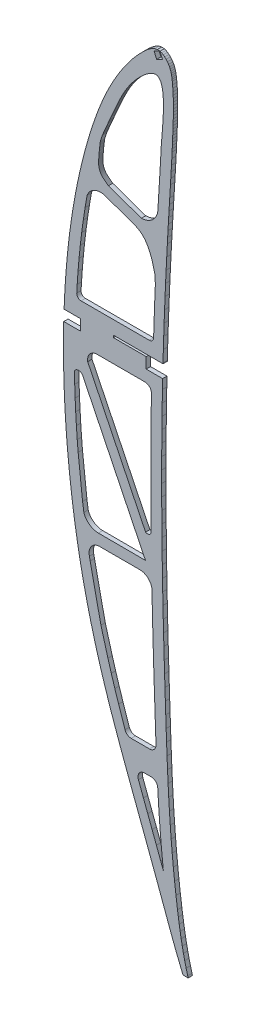
from build123d import *

# Parameters (mm, degrees)
EXTRUDE_1_DEPTH = 2


with BuildPart() as part:
    # Model → 凸台-拉伸1 (new body)
    with BuildSketch(Plane.XY):
        Polygon((80.885342789, 6.786923062), (80.601285788, 7.440020981), (79.497409228, 10.095397892), (78.416118202, 12.760769483), (77.376315784, 15.392919162), (76.35914252, 18.034064472), (75.360689456, 20.682032841), (74.374050493, 23.334520834), (73.397227535, 25.991441215), (71.451399527, 31.309627124), (69.494800085, 36.622337978), (67.525561971, 41.926489395), (65.544509756, 47.226121186), (63.556595062, 52.522450497), (61.563728747, 57.817562663), (59.568864334, 63.11258759), (57.573869064, 68.410609661), (55.594993621, 73.68331077), (53.630929423, 78.960662362), (51.691579715, 84.245098729), (49.786716882, 89.542051304), (47.926244166, 94.853954379), (46.12193205, 100.186326626), (44.381685681, 105.541515099), (42.751569504, 110.804419548), (41.194554126, 116.089533749), (39.713723933, 121.394990463), (38.308036255, 126.721745117), (36.980575476, 132.067930475), (35.731297978, 137.434545585), (34.562289094, 142.819679588), (33.490505817, 148.132986148), (32.495213059, 153.459641884), (31.574456343, 158.798560507), (30.725238524, 164.149611161), (29.946647794, 169.510752129), (29.23460072, 174.883807029), (28.588229112, 180.265735099), (28.009059649, 185.621569649), (27.491700318, 190.983105746), (27.039235501, 196.348476152), (26.650666152, 201.717637247), (26.326904079, 207.092630746), (26.069035569, 212.471502174), (25.877060622, 217.854251529), (25.752715618, 223.24696034), (25.696436752, 228.639638124), (25.710265739, 234.031373073), (25.810776934, 240.410765271), (33.537489591, 240.410765271), (33.537489591, 245.410765271), (32.537489591, 245.410765271), (25.979034241, 245.410765271), (26.185431064, 250.200488909), (26.493721757, 255.588064138), (26.883489816, 261.035250096), (27.356702309, 266.474067885), (27.915400954, 271.903605694), (28.564668229, 277.322083525), (29.307544899, 282.728633188), (30.148201634, 288.119432966), (31.091590056, 293.495700006), (31.613596949, 296.235076907), (32.163926147, 298.967682765), (32.741578602, 301.69347396), (33.347509743, 304.413493161), (33.982718618, 307.127783986), (34.647292466, 309.83434834), (35.342143097, 312.535227938), (36.086283452, 315.299317685), (36.864827641, 318.054900009), (37.677906521, 320.798977766), (38.529559905, 323.530726384), (39.42174227, 326.251232151), (40.355583523, 328.957541541), (41.335079855, 331.649829032), (41.861937078, 333.040133483), (42.401000977, 334.425966126), (42.954356886, 335.805416102), (43.522004806, 337.178483413), (44.105031024, 338.54321358), (44.704347349, 339.90164832), (45.319085592, 341.250746868), (45.983418895, 342.656062229), (46.667170308, 344.052215875), (47.371382499, 345.438252379), (48.097010896, 346.815214408), (48.843012832, 348.184057391), (49.6133845, 349.544955805), (50.406084184, 350.898821459), (51.290461417, 352.353782253), (52.200469146, 353.794847808), (53.134283753, 355.217934692), (54.090212476, 356.61596233), (55.067387126, 357.985889957), (56.062073226, 359.321548806), (57.074532492, 360.616944589), (57.704274161, 361.393152313), (58.345572413, 362.156852223), (59.003073533, 362.916254802), (59.682597333, 363.675617959), (60.388877339, 364.441154081), (61.12868879, 365.218163744), (61.905766163, 366.012815716), (62.991241546, 367.080179381), (64.135883069, 368.12209962), (65.325585791, 369.071897721), (66.545245724, 369.862851353), (67.77975888, 370.428238183), (69.014976699, 370.702378549), (70.233797096, 370.618462879), (70.980747161, 370.360799144), (71.7049624, 369.959006552), (72.395405466, 369.436626065), (73.04021444, 368.813158834), (73.629307403, 368.113188492), (74.151821486, 367.356259808), (74.596675722, 366.566912794), (74.920109097, 365.853341598), (75.182862247, 365.13111533), (75.392840319, 364.402581041), (75.559034747, 363.668131307), (75.691436013, 362.928202321), (75.797949264, 362.185141134), (75.887609553, 361.438341273), (76.026895199, 360.105147923), (76.142421785, 358.765912466), (76.2350575, 357.423675667), (76.306800442, 356.078524765), (76.359605087, 354.731546046), (76.394470483, 353.38278313), (76.41230844, 352.034277732), (76.414161626, 350.685074424), (76.403027184, 349.335304064), (76.379773306, 347.988007417), (76.346528946, 346.640274575), (76.306247629, 345.293235446), (76.259928403, 343.946933649), (76.210655651, 342.599501945), (76.158472994, 341.249941287), (76.105291289, 339.900337009), (76.049068819, 338.551600921), (75.991847301, 337.202821214), (75.931672258, 335.852911601), (75.8694555, 334.503913797), (75.805240644, 333.154828755), (75.667950358, 330.45326895), (75.521625018, 327.752315619), (75.368262722, 325.052056001), (75.208862516, 322.352533715), (75.046421547, 319.653879618), (74.715632558, 314.254311613), (74.552279779, 311.553615801), (74.389926048, 308.852963608), (74.229526794, 306.153397702), (74.072124686, 303.453962655), (73.916720673, 300.754614846), (73.764401044, 298.053399799), (73.616077608, 295.352359229), (73.329203121, 289.955709525), (73.057314357, 284.559714112), (72.801410365, 279.164416609), (72.560535716, 273.768774348), (72.335733076, 268.371831902), (72.128045115, 262.97263384), (71.938427261, 257.572222831), (71.76548789, 252.179546688), (71.610487769, 246.788654743), (71.600881766, 246.410765271), (48.775461629, 246.410765271), (48.775461629, 245.410765271), (63.871911287, 245.410765271), (63.871911287, 240.410765271), (71.429246642, 240.410765271), (71.35352432, 236.007184585), (71.251604612, 230.615607323), (71.166755962, 225.222773494), (71.09997742, 219.828726717), (71.0499646, 214.440416711), (71.016891981, 209.053847283), (70.999804133, 203.667975766), (70.998744676, 198.28180311), (71.012670942, 192.896284745), (71.040671123, 187.509378955), (71.081746169, 182.121042121), (71.136677032, 176.736313102), (71.204551902, 171.353150184), (71.284415351, 165.970510699), (71.377222808, 160.589437314), (71.482062462, 155.207888313), (71.597935267, 149.825820078), (71.726882937, 144.442320798), (71.86577747, 139.06025676), (72.015574294, 133.680670631), (72.174318934, 128.302476126), (72.341055958, 122.924630575), (72.513830892, 117.546047693), (72.692643735, 112.166727479), (72.875540009, 106.785583646), (73.062432476, 101.40461429), (73.258229138, 96.026035605), (73.467968856, 90.64906664), (73.699687634, 85.273057302), (73.957338047, 79.899181116), (74.248000671, 74.525745321), (74.577669795, 69.153011634), (74.951602376, 63.775203863), (75.373358414, 58.402486967), (75.844979624, 53.033949137), (76.371417628, 47.670807518), (76.954714142, 42.3121503), (77.597866311, 36.958108342), (78.303871279, 31.608812502), (78.685654071, 28.916903532), (79.090240496, 26.229994002), (79.520671315, 23.54721572), (79.984764439, 20.872913835), (80.487602346, 18.205308347), (81.03404942, 15.547614498), (81.630056331, 12.901093052), (82.290878913, 10.214360555), (83.001174093, 7.540798557), (83.228266295, 6.786923062), align=None)
        with BuildLine():
            Line((70.807880879, 333.155263593), (70.667950358, 330.45326895))
            Line((70.667950358, 330.45326895), (70.521625018, 327.752315619))
            Line((70.521625018, 327.752315619), (70.368262722, 325.052056001))
            Line((70.368262722, 325.052056001), (70.208862516, 322.352533715))
            Line((70.208862516, 322.352533715), (70.046421547, 319.653879618))
            Line((70.046421547, 319.653879618), (69.715632558, 314.254311613))
            Line((69.715632558, 314.254311613), (69.552279779, 311.553615801))
            Line((69.552279779, 311.553615801), (69.389926048, 308.852963608))
            Line((69.389926048, 308.852963608), (69.229526794, 306.153397702))
            ThreePointArc((69.229526794, 306.153397702), (66.64857513, 301.480661696), (61.657880879, 299.586263593))
            Line((61.657880879, 299.586263593), (46.437880879, 304.950388594))
            Line((46.437880879, 304.950388594), (46.367880879, 305.000263593))
            Line((46.367880879, 305.000263593), (46.287880879, 305.058263593))
            Line((46.287880879, 305.058263593), (46.207880879, 305.116263593))
            Line((46.207880879, 305.116263593), (46.127880879, 305.173263593))
            Line((46.127880879, 305.173263593), (46.047880879, 305.231263593))
            Line((46.047880879, 305.231263593), (45.967880879, 305.289263593))
            Line((45.967880879, 305.289263593), (45.887880879, 305.346263593))
            Line((45.887880879, 305.346263593), (45.807880879, 305.404263593))
            Line((45.807880879, 305.404263593), (45.727880879, 305.462263593))
            Line((45.727880879, 305.462263593), (45.647880879, 305.520263593))
            Line((45.647880879, 305.520263593), (45.567880879, 305.579263593))
            Line((45.567880879, 305.579263593), (45.497880879, 305.637263593))
            Line((45.497880879, 305.637263593), (45.417880879, 305.695263593))
            Line((45.417880879, 305.695263593), (45.337880879, 305.754263593))
            Line((45.337880879, 305.754263593), (45.257880879, 305.813263593))
            Line((45.257880879, 305.813263593), (45.187880879, 305.872263593))
            Line((45.187880879, 305.872263593), (45.107880879, 305.931263593))
            Line((45.107880879, 305.931263593), (45.027880879, 305.990263593))
            Line((45.027880879, 305.990263593), (44.957880879, 306.050263593))
            Line((44.957880879, 306.050263593), (44.877880879, 306.110263593))
            Line((44.877880879, 306.110263593), (44.807880879, 306.170263593))
            Line((44.807880879, 306.170263593), (44.727880879, 306.230263593))
            Line((44.727880879, 306.230263593), (44.657880879, 306.291263593))
            Line((44.657880879, 306.291263593), (44.587880879, 306.352263593))
            Line((44.587880879, 306.352263593), (44.507880879, 306.413263593))
            Line((44.507880879, 306.413263593), (44.437880879, 306.474263593))
            Line((44.437880879, 306.474263593), (44.367880879, 306.536263593))
            Line((44.367880879, 306.536263593), (44.297880879, 306.598263593))
            Line((44.297880879, 306.598263593), (44.227880879, 306.660263593))
            Line((44.227880879, 306.660263593), (44.157880879, 306.723263593))
            Line((44.157880879, 306.723263593), (44.087880879, 306.786263593))
            Line((44.087880879, 306.786263593), (44.017880879, 306.850263593))
            Line((44.017880879, 306.850263593), (43.947880879, 306.914263593))
            Line((43.947880879, 306.914263593), (43.887880879, 306.978263593))
            Line((43.887880879, 306.978263593), (43.817880879, 307.043263593))
            Line((43.817880879, 307.043263593), (43.757880879, 307.108263593))
            Line((43.757880879, 307.108263593), (43.687880879, 307.173263593))
            Line((43.687880879, 307.173263593), (43.627880879, 307.239263593))
            Line((43.627880879, 307.239263593), (43.567880879, 307.305263593))
            Line((43.567880879, 307.305263593), (43.497880879, 307.372263593))
            Line((43.497880879, 307.372263593), (43.437880879, 307.440263593))
            Line((43.437880879, 307.440263593), (43.377880879, 307.507263593))
            Line((43.377880879, 307.507263593), (43.327880879, 307.576263593))
            Line((43.327880879, 307.576263593), (43.267880879, 307.645263593))
            Line((43.267880879, 307.645263593), (43.207880879, 307.714263593))
            Line((43.207880879, 307.714263593), (43.157880879, 307.784263593))
            Line((43.157880879, 307.784263593), (43.097880879, 307.854263593))
            Line((43.097880879, 307.854263593), (43.047880879, 307.925263593))
            Line((43.047880879, 307.925263593), (42.997880879, 307.997263593))
            Line((42.997880879, 307.997263593), (42.937880879, 308.069263593))
            Line((42.937880879, 308.069263593), (42.897880879, 308.142263593))
            Line((42.897880879, 308.142263593), (42.847880879, 308.215263593))
            Line((42.847880879, 308.215263593), (42.797880879, 308.289263593))
            Line((42.797880879, 308.289263593), (42.747880879, 308.364263593))
            Line((42.747880879, 308.364263593), (42.707880879, 308.439263593))
            Line((42.707880879, 308.439263593), (42.657880879, 308.515263593))
            Line((42.657880879, 308.515263593), (42.617880879, 308.592263593))
            Line((42.617880879, 308.592263593), (42.577880879, 308.669263593))
            Line((42.577880879, 308.669263593), (42.537880879, 308.747263593))
            Line((42.537880879, 308.747263593), (42.497880879, 308.826263593))
            Line((42.497880879, 308.826263593), (42.467880879, 308.905263593))
            Line((42.467880879, 308.905263593), (42.427880879, 308.985263593))
            Line((42.427880879, 308.985263593), (42.397880879, 309.066263593))
            Line((42.397880879, 309.066263593), (42.357880879, 309.148263593))
            Line((42.357880879, 309.148263593), (42.327880879, 309.230263593))
            Line((42.327880879, 309.230263593), (42.297880879, 309.313263593))
            Line((42.297880879, 309.313263593), (42.267880879, 309.396263593))
            Line((42.267880879, 309.396263593), (42.247880879, 309.481263593))
            Line((42.247880879, 309.481263593), (42.217880879, 309.566263593))
            Line((42.217880879, 309.566263593), (42.197880879, 309.651263593))
            Line((42.197880879, 309.651263593), (42.167880879, 309.737263593))
            Line((42.167880879, 309.737263593), (42.147880879, 309.824263593))
            Line((42.147880879, 309.824263593), (42.127880879, 309.911263593))
            Line((42.127880879, 309.911263593), (42.107880879, 309.999263593))
            Line((42.107880879, 309.999263593), (42.087880879, 310.087263593))
            Line((42.087880879, 310.087263593), (42.067880879, 310.176263593))
            Line((42.067880879, 310.176263593), (42.057880879, 310.265263593))
            Line((42.057880879, 310.265263593), (42.037880879, 310.354263593))
            Line((42.037880879, 310.354263593), (42.027880879, 310.445263593))
            Line((42.027880879, 310.445263593), (42.007880879, 310.535263593))
            Line((42.007880879, 310.535263593), (41.997880879, 310.626263593))
            Line((41.997880879, 310.626263593), (41.987880879, 310.718263593))
            Line((41.987880879, 310.718263593), (41.977880879, 310.809263593))
            Line((41.977880879, 310.809263593), (41.967880879, 310.902263593))
            Line((41.967880879, 310.902263593), (41.957880879, 310.994263593))
            Line((41.957880879, 310.994263593), (41.947880879, 311.087263593))
            Line((41.947880879, 311.087263593), (41.947880879, 311.180263593))
            Line((41.947880879, 311.180263593), (41.937880879, 311.274263593))
            Line((41.937880879, 311.274263593), (41.927880879, 311.367263593))
            Line((41.927880879, 311.367263593), (41.927880879, 311.461263593))
            Line((41.927880879, 311.461263593), (41.927880879, 311.556263593))
            Line((41.927880879, 311.556263593), (41.917880879, 311.650263593))
            Line((41.917880879, 311.650263593), (41.917880879, 311.745263593))
            Line((41.917880879, 311.745263593), (41.917880879, 311.840263593))
            Line((41.917880879, 311.840263593), (41.917880879, 311.935263593))
            Line((41.917880879, 311.935263593), (41.907880879, 312.030263593))
            Line((41.907880879, 312.030263593), (41.907880879, 312.125263593))
            Line((41.907880879, 312.125263593), (41.907880879, 312.221263593))
            Line((41.907880879, 312.221263593), (41.917880879, 312.317263593))
            Line((41.917880879, 312.317263593), (41.917880879, 312.412263593))
            Line((41.917880879, 312.412263593), (41.917880879, 312.508263593))
            Line((41.917880879, 312.508263593), (41.917880879, 312.604263593))
            Line((41.917880879, 312.604263593), (41.917880879, 312.700263593))
            Line((41.917880879, 312.700263593), (41.927880879, 312.796263593))
            Line((41.927880879, 312.796263593), (41.927880879, 312.892263593))
            Line((41.927880879, 312.892263593), (41.927880879, 312.988263593))
            Line((41.927880879, 312.988263593), (41.937880879, 313.084263593))
            Line((41.937880879, 313.084263593), (41.937880879, 313.180263593))
            Line((41.937880879, 313.180263593), (41.947880879, 313.275263593))
            Line((41.947880879, 313.275263593), (41.947880879, 313.371263593))
            Line((41.947880879, 313.371263593), (41.957880879, 313.467263593))
            Line((41.957880879, 313.467263593), (41.957880879, 313.562263593))
            Line((41.957880879, 313.562263593), (41.967880879, 313.658263593))
            Line((41.967880879, 313.658263593), (41.967880879, 313.753263593))
            Line((41.967880879, 313.753263593), (41.977880879, 313.848263593))
            Line((41.977880879, 313.848263593), (41.977880879, 313.943263593))
            Line((41.977880879, 313.943263593), (41.987880879, 314.038263593))
            Line((41.987880879, 314.038263593), (41.997880879, 314.133263593))
            Line((41.997880879, 314.133263593), (41.997880879, 314.227263593))
            Line((41.997880879, 314.227263593), (42.007880879, 314.322263593))
            Line((42.007880879, 314.322263593), (42.017880879, 314.416263593))
            Line((42.017880879, 314.416263593), (42.017880879, 314.510263593))
            Line((42.017880879, 314.510263593), (42.027880879, 314.604263593))
            Line((42.027880879, 314.604263593), (42.037880879, 314.698263593))
            Line((42.037880879, 314.698263593), (42.037880879, 314.792263593))
            Line((42.037880879, 314.792263593), (42.047880879, 314.886263593))
            Line((42.047880879, 314.886263593), (42.057880879, 314.979263593))
            Line((42.057880879, 314.979263593), (42.067880879, 315.073263593))
            Line((42.067880879, 315.073263593), (42.067880879, 315.166263593))
            Line((42.067880879, 315.166263593), (42.077880879, 315.259263593))
            Line((42.077880879, 315.259263593), (42.087880879, 315.352263593))
            Line((42.087880879, 315.352263593), (42.097880879, 315.445263593))
            Line((42.097880879, 315.445263593), (42.097880879, 315.538263593))
            Line((42.097880879, 315.538263593), (42.107880879, 315.631263593))
            Line((42.107880879, 315.631263593), (42.117880879, 315.724263593))
            Line((42.117880879, 315.724263593), (42.127880879, 315.816263593))
            Line((42.127880879, 315.816263593), (42.137880879, 315.909263593))
            Line((42.137880879, 315.909263593), (42.137880879, 316.001263593))
            Line((42.137880879, 316.001263593), (42.147880879, 316.093263593))
            Line((42.147880879, 316.093263593), (42.157880879, 316.185263593))
            Line((42.157880879, 316.185263593), (42.167880879, 316.277263593))
            Line((42.167880879, 316.277263593), (42.177880879, 316.369263593))
            Line((42.177880879, 316.369263593), (42.187880879, 316.461263593))
            Line((42.187880879, 316.461263593), (42.197880879, 316.553263593))
            Line((42.197880879, 316.553263593), (42.207880879, 316.645263593))
            Line((42.207880879, 316.645263593), (42.207880879, 316.736263593))
            Line((42.207880879, 316.736263593), (42.217880879, 316.828263593))
            Line((42.217880879, 316.828263593), (42.227880879, 316.919263593))
            Line((42.227880879, 316.919263593), (42.237880879, 317.010263593))
            Line((42.237880879, 317.010263593), (42.247880879, 317.102263593))
            Line((42.247880879, 317.102263593), (42.257880879, 317.193263593))
            Line((42.257880879, 317.193263593), (42.267880879, 317.284263593))
            Line((42.267880879, 317.284263593), (42.277880879, 317.375263593))
            Line((42.277880879, 317.375263593), (42.287880879, 317.466263593))
            Line((42.287880879, 317.466263593), (42.297880879, 317.557263593))
            Line((42.297880879, 317.557263593), (42.307880879, 317.648263593))
            Line((42.307880879, 317.648263593), (42.317880879, 317.738263593))
            Line((42.317880879, 317.738263593), (42.327880879, 317.829263593))
            Line((42.327880879, 317.829263593), (42.337880879, 317.920263593))
            Line((42.337880879, 317.920263593), (42.347880879, 318.010263593))
            Line((42.347880879, 318.010263593), (42.357880879, 318.101263593))
            Line((42.357880879, 318.101263593), (42.367880879, 318.191263593))
            Line((42.367880879, 318.191263593), (42.377880879, 318.282263593))
            Line((42.377880879, 318.282263593), (42.387880879, 318.372263593))
            Line((42.387880879, 318.372263593), (42.397880879, 318.462263593))
            Line((42.397880879, 318.462263593), (42.407880879, 318.553263593))
            Line((42.407880879, 318.553263593), (42.417880879, 318.643263593))
            Line((42.417880879, 318.643263593), (42.427880879, 318.733263593))
            Line((42.427880879, 318.733263593), (42.437880879, 318.823263593))
            Line((42.437880879, 318.823263593), (42.447880879, 318.913263593))
            Line((42.447880879, 318.913263593), (42.457880879, 319.003263593))
            Line((42.457880879, 319.003263593), (42.467880879, 319.093263593))
            Line((42.467880879, 319.093263593), (42.477880879, 319.183263593))
            Line((42.477880879, 319.183263593), (42.497880879, 319.273263593))
            Line((42.497880879, 319.273263593), (42.507880879, 319.363263593))
            Line((42.507880879, 319.363263593), (42.517880879, 319.453263593))
            Line((42.517880879, 319.453263593), (42.527880879, 319.543263593))
            Line((42.527880879, 319.543263593), (42.537880879, 319.633263593))
            Line((42.537880879, 319.633263593), (42.547880879, 319.722263593))
            Line((42.547880879, 319.722263593), (42.557880879, 319.812263593))
            Line((42.557880879, 319.812263593), (42.567880879, 319.902263593))
            Line((42.567880879, 319.902263593), (42.577880879, 319.992263593))
            Line((42.577880879, 319.992263593), (42.587880879, 320.081263593))
            Line((42.587880879, 320.081263593), (42.597880879, 320.171263593))
            Line((42.597880879, 320.171263593), (42.607880879, 320.261263593))
            Line((42.607880879, 320.261263593), (42.627880879, 320.350263593))
            Line((42.627880879, 320.350263593), (42.637880879, 320.440263593))
            Line((42.637880879, 320.440263593), (42.647880879, 320.530263593))
            Line((42.647880879, 320.530263593), (42.657880879, 320.619263593))
            Line((42.657880879, 320.619263593), (42.667880879, 320.709263593))
            Line((42.667880879, 320.709263593), (42.677880879, 320.799263593))
            Line((42.677880879, 320.799263593), (43.657880879, 323.830263593))
            Line((43.657880879, 323.830263593), (43.787880879, 324.130263593))
            Line((43.787880879, 324.130263593), (43.917880879, 324.430263593))
            Line((43.917880879, 324.430263593), (44.037880879, 324.729263593))
            Line((44.037880879, 324.729263593), (44.167880879, 325.029263593))
            Line((44.167880879, 325.029263593), (44.297880879, 325.329263593))
            Line((44.297880879, 325.329263593), (44.427880879, 325.628263593))
            Line((44.427880879, 325.628263593), (44.557880879, 325.928263593))
            Line((44.557880879, 325.928263593), (44.687880879, 326.227263593))
            Line((44.687880879, 326.227263593), (44.807880879, 326.526263593))
            Line((44.807880879, 326.526263593), (44.937880879, 326.826263593))
            Line((44.937880879, 326.826263593), (45.067880879, 327.125263593))
            Line((45.067880879, 327.125263593), (45.197880879, 327.424263593))
            Line((45.197880879, 327.424263593), (45.327880879, 327.722263593))
            Line((45.327880879, 327.722263593), (45.457880879, 328.021263593))
            Line((45.457880879, 328.021263593), (45.577880879, 328.320263593))
            Line((45.577880879, 328.320263593), (45.707880879, 328.618263593))
            Line((45.707880879, 328.618263593), (45.837880879, 328.916263593))
            Line((45.837880879, 328.916263593), (45.967880879, 329.214263593))
            Line((45.967880879, 329.214263593), (46.097880879, 329.512263593))
            Line((46.097880879, 329.512263593), (46.227880879, 329.809263593))
            Line((46.227880879, 329.809263593), (46.347880879, 330.106263593))
            Line((46.347880879, 330.106263593), (46.477880879, 330.404263593))
            Line((46.477880879, 330.404263593), (46.607880879, 330.700263593))
            Line((46.607880879, 330.700263593), (46.737880879, 330.997263593))
            Line((46.737880879, 330.997263593), (46.867880879, 331.293263593))
            Line((46.867880879, 331.293263593), (46.987880879, 331.589263593))
            Line((46.987880879, 331.589263593), (47.117880879, 331.885263593))
            Line((47.117880879, 331.885263593), (47.247880879, 332.180263593))
            Line((47.247880879, 332.180263593), (47.377880879, 332.475263593))
            Line((47.377880879, 332.475263593), (47.507880879, 332.770263593))
            Line((47.507880879, 332.770263593), (47.637880879, 333.065263593))
            Line((47.637880879, 333.065263593), (47.767880879, 333.359263593))
            Line((47.767880879, 333.359263593), (47.887880879, 333.653263593))
            Line((47.887880879, 333.653263593), (48.017880879, 333.946263593))
            Line((48.017880879, 333.946263593), (48.147880879, 334.239263593))
            Line((48.147880879, 334.239263593), (48.277880879, 334.532263593))
            Line((48.277880879, 334.532263593), (48.407880879, 334.824263593))
            Line((48.407880879, 334.824263593), (48.537880879, 335.116263593))
            Line((48.537880879, 335.116263593), (48.657880879, 335.407263593))
            Line((48.657880879, 335.407263593), (48.787880879, 335.698263593))
            Line((48.787880879, 335.698263593), (48.917880879, 335.989263593))
            Line((48.917880879, 335.989263593), (49.047880879, 336.279263593))
            Line((49.047880879, 336.279263593), (49.177880879, 336.569263593))
            Line((49.177880879, 336.569263593), (49.307880879, 336.858263593))
            Line((49.307880879, 336.858263593), (49.437880879, 337.146263593))
            Line((49.437880879, 337.146263593), (49.557880879, 337.435263593))
            Line((49.557880879, 337.435263593), (49.687880879, 337.722263593))
            Line((49.687880879, 337.722263593), (49.817880879, 338.009263593))
            Line((49.817880879, 338.009263593), (49.947880879, 338.296263593))
            Line((49.947880879, 338.296263593), (50.077880879, 338.582263593))
            Line((50.077880879, 338.582263593), (50.207880879, 338.868263593))
            Line((50.207880879, 338.868263593), (50.337880879, 339.153263593))
            Line((50.337880879, 339.153263593), (50.457880879, 339.437263593))
            Line((50.457880879, 339.437263593), (50.587880879, 339.721263593))
            Line((50.587880879, 339.721263593), (50.717880879, 340.005263593))
            Line((50.717880879, 340.005263593), (50.847880879, 340.288263593))
            Line((50.847880879, 340.288263593), (50.977880879, 340.570263593))
            Line((50.977880879, 340.570263593), (51.107880879, 340.852263593))
            Line((51.107880879, 340.852263593), (51.237880879, 341.134263593))
            Line((51.237880879, 341.134263593), (51.377880879, 341.415263593))
            Line((51.377880879, 341.415263593), (51.507880879, 341.696263593))
            Line((51.507880879, 341.696263593), (51.637880879, 341.976263593))
            Line((51.637880879, 341.976263593), (51.777880879, 342.255263593))
            Line((51.777880879, 342.255263593), (51.907880879, 342.535263593))
            Line((51.907880879, 342.535263593), (52.047880879, 342.814263593))
            Line((52.047880879, 342.814263593), (52.177880879, 343.092263593))
            Line((52.177880879, 343.092263593), (52.317880879, 343.370263593))
            Line((52.317880879, 343.370263593), (52.457880879, 343.648263593))
            Line((52.457880879, 343.648263593), (52.597880879, 343.925263593))
            Line((52.597880879, 343.925263593), (52.747880879, 344.202263593))
            Line((52.747880879, 344.202263593), (52.887880879, 344.479263593))
            Line((52.887880879, 344.479263593), (53.037880879, 344.755263593))
            Line((53.037880879, 344.755263593), (53.177880879, 345.031263593))
            Line((53.177880879, 345.031263593), (53.327880879, 345.307263593))
            Line((53.327880879, 345.307263593), (53.477880879, 345.582263593))
            Line((53.477880879, 345.582263593), (53.627880879, 345.857263593))
            Line((53.627880879, 345.857263593), (53.787880879, 346.132263593))
            Line((53.787880879, 346.132263593), (53.937880879, 346.406263593))
            Line((53.937880879, 346.406263593), (54.097880879, 346.680263593))
            Line((54.097880879, 346.680263593), (54.257880879, 346.954263593))
            Line((54.257880879, 346.954263593), (54.417880879, 347.228263593))
            Line((54.417880879, 347.228263593), (54.587880879, 347.501263593))
            Line((54.587880879, 347.501263593), (54.757880879, 347.774263593))
            Line((54.757880879, 347.774263593), (54.927880879, 348.047263593))
            Line((54.927880879, 348.047263593), (55.097880879, 348.320263593))
            Line((55.097880879, 348.320263593), (55.267880879, 348.592263593))
            Line((55.267880879, 348.592263593), (55.447880879, 348.865263593))
            Line((55.447880879, 348.865263593), (55.627880879, 349.137263593))
            Line((55.627880879, 349.137263593), (55.807880879, 349.409263593))
            Line((55.807880879, 349.409263593), (55.997880879, 349.680263593))
            Line((55.997880879, 349.680263593), (56.177880879, 349.952263593))
            Line((56.177880879, 349.952263593), (56.377880879, 350.223263593))
            Line((56.377880879, 350.223263593), (56.567880879, 350.495263593))
            Line((56.567880879, 350.495263593), (56.767880879, 350.766263593))
            Line((56.767880879, 350.766263593), (56.967880879, 351.037263593))
            Line((56.967880879, 351.037263593), (57.167880879, 351.308263593))
            Line((57.167880879, 351.308263593), (57.377880879, 351.579263593))
            Line((57.377880879, 351.579263593), (57.587880879, 351.850263593))
            Line((57.587880879, 351.850263593), (57.807880879, 352.120263593))
            Line((57.807880879, 352.120263593), (58.017880879, 352.391263593))
            Line((58.017880879, 352.391263593), (58.237880879, 352.661263593))
            Line((58.237880879, 352.661263593), (58.467880879, 352.932263593))
            Line((58.467880879, 352.932263593), (58.697880879, 353.202263593))
            Line((58.697880879, 353.202263593), (58.927880879, 353.473263593))
            Line((58.927880879, 353.473263593), (59.167880879, 353.743263593))
            Line((59.167880879, 353.743263593), (59.407880879, 354.014263593))
            Line((59.407880879, 354.014263593), (59.647880879, 354.284263593))
            Line((59.647880879, 354.284263593), (59.897880879, 354.553263593))
            Line((59.897880879, 354.553263593), (60.147880879, 354.822263593))
            Line((60.147880879, 354.822263593), (60.407880879, 355.089263593))
            Line((60.407880879, 355.089263593), (60.667880879, 355.354263593))
            Line((60.667880879, 355.354263593), (60.927880879, 355.617263593))
            Line((60.927880879, 355.617263593), (61.187880879, 355.877263593))
            Line((61.187880879, 355.877263593), (61.447880879, 356.134263593))
            Line((61.447880879, 356.134263593), (61.717880879, 356.387263593))
            Line((61.717880879, 356.387263593), (61.977880879, 356.637263593))
            Line((61.977880879, 356.637263593), (62.247880879, 356.882263593))
            Line((62.247880879, 356.882263593), (62.507880879, 357.122263593))
            Line((62.507880879, 357.122263593), (62.777880879, 357.356263593))
            Line((62.777880879, 357.356263593), (63.047880879, 357.585263593))
            Line((63.047880879, 357.585263593), (63.307880879, 357.808263593))
            Line((63.307880879, 357.808263593), (63.577880879, 358.025263593))
            Line((63.577880879, 358.025263593), (63.837880879, 358.234263593))
            Line((63.837880879, 358.234263593), (64.107880879, 358.437263593))
            Line((64.107880879, 358.437263593), (64.367880879, 358.631263593))
            Line((64.367880879, 358.631263593), (64.627880879, 358.817263593))
            Line((64.627880879, 358.817263593), (64.877880879, 358.994263593))
            Line((64.877880879, 358.994263593), (65.137880879, 359.163263593))
            Line((65.137880879, 359.163263593), (65.387880879, 359.322263593))
            Line((65.387880879, 359.322263593), (65.627880879, 359.471263593))
            Line((65.627880879, 359.471263593), (65.877880879, 359.610263593))
            Line((65.877880879, 359.610263593), (66.117880879, 359.737263593))
            Line((66.117880879, 359.737263593), (66.347880879, 359.854263593))
            Line((66.347880879, 359.854263593), (66.577880879, 359.959263593))
            Line((66.577880879, 359.959263593), (66.807880879, 360.053263593))
            Line((66.807880879, 360.053263593), (67.027880879, 360.133263593))
            Line((67.027880879, 360.133263593), (67.237880879, 360.201263593))
            Line((67.237880879, 360.201263593), (67.447880879, 360.256263593))
            Line((67.447880879, 360.256263593), (67.647880879, 360.297263593))
            Line((67.647880879, 360.297263593), (67.847880879, 360.326263593))
            Line((67.847880879, 360.326263593), (68.037880879, 360.341263593))
            Line((68.037880879, 360.341263593), (68.227880879, 360.344263593))
            Line((68.227880879, 360.344263593), (68.407880879, 360.334263593))
            Line((68.407880879, 360.334263593), (68.577880879, 360.311263593))
            Line((68.577880879, 360.311263593), (68.747880879, 360.277263593))
            Line((68.747880879, 360.277263593), (68.907880879, 360.230263593))
            Line((68.907880879, 360.230263593), (69.067880879, 360.171263593))
            Line((69.067880879, 360.171263593), (69.227880879, 360.100263593))
            Line((69.227880879, 360.100263593), (69.367880879, 360.018263593))
            Line((69.367880879, 360.018263593), (69.517880879, 359.924263593))
            Line((69.517880879, 359.924263593), (69.647880879, 359.819263593))
            Line((69.647880879, 359.819263593), (69.777880879, 359.703263593))
            Line((69.777880879, 359.703263593), (69.907880879, 359.575263593))
            Line((69.907880879, 359.575263593), (70.027880879, 359.437263593))
            Line((70.027880879, 359.437263593), (70.147880879, 359.288263593))
            Line((70.147880879, 359.288263593), (70.257880879, 359.129263593))
            Line((70.257880879, 359.129263593), (70.367880879, 358.959263593))
            Line((70.367880879, 358.959263593), (70.477880879, 358.779263593))
            Line((70.477880879, 358.779263593), (70.577880879, 358.588263593))
            Line((70.577880879, 358.588263593), (70.667880879, 358.388263593))
            Line((70.667880879, 358.388263593), (70.757880879, 358.178263593))
            Line((70.757880879, 358.178263593), (70.847880879, 357.959263593))
            Line((70.847880879, 357.959263593), (70.927880879, 357.730263593))
            Line((70.927880879, 357.730263593), (71.007880879, 357.491263593))
            Line((71.007880879, 357.491263593), (71.077880879, 357.244263593))
            Line((71.077880879, 357.244263593), (71.147880879, 356.988263593))
            Line((71.147880879, 356.988263593), (71.217880879, 356.722263593))
            Line((71.217880879, 356.722263593), (71.277880879, 356.448263593))
            Line((71.277880879, 356.448263593), (71.337880879, 356.166263593))
            Line((71.337880879, 356.166263593), (71.387880879, 355.875263593))
            Line((71.387880879, 355.875263593), (71.437880879, 355.576263593))
            Line((71.437880879, 355.576263593), (71.487880879, 355.269263593))
            Line((71.487880879, 355.269263593), (71.527880879, 354.954263593))
            Line((71.527880879, 354.954263593), (71.567880879, 354.632263593))
            Line((71.567880879, 354.632263593), (71.607880879, 354.302263593))
            Line((71.607880879, 354.302263593), (71.637880879, 353.964263593))
            Line((71.637880879, 353.964263593), (71.667880879, 353.619263593))
            Line((71.667880879, 353.619263593), (71.697880879, 353.267263593))
            Line((71.697880879, 353.267263593), (71.717880879, 352.908263593))
            Line((71.717880879, 352.908263593), (71.737880879, 352.543263593))
            Line((71.737880879, 352.543263593), (71.757880879, 352.171263593))
            Line((71.757880879, 352.171263593), (71.767880879, 351.792263593))
            Line((71.767880879, 351.792263593), (71.787880879, 351.407263593))
            Line((71.787880879, 351.407263593), (71.797880879, 351.016263593))
            Line((71.797880879, 351.016263593), (71.797880879, 350.619263593))
            Line((71.797880879, 350.619263593), (71.807880879, 350.216263593))
            Line((71.807880879, 350.216263593), (71.807880879, 349.807263593))
            Line((71.807880879, 349.807263593), (71.807880879, 349.393263593))
            Line((71.807880879, 349.393263593), (71.797880879, 348.973263593))
            Line((71.797880879, 348.973263593), (71.797880879, 348.548263593))
            Line((71.797880879, 348.548263593), (71.787880879, 348.119263593))
            Line((71.787880879, 348.119263593), (71.777880879, 347.684263593))
            Line((71.777880879, 347.684263593), (71.767880879, 347.245263593))
            Line((71.767880879, 347.245263593), (71.747880879, 346.801263593))
            Line((71.747880879, 346.801263593), (71.737880879, 346.352263593))
            Line((71.737880879, 346.352263593), (71.717880879, 345.900263593))
            Line((71.717880879, 345.900263593), (71.697880879, 345.443263593))
            Line((71.697880879, 345.443263593), (71.677880879, 344.982263593))
            Line((71.677880879, 344.982263593), (71.647880879, 344.518263593))
            Line((71.647880879, 344.518263593), (71.627880879, 344.050263593))
            Line((71.627880879, 344.050263593), (71.597880879, 343.578263593))
            Line((71.597880879, 343.578263593), (71.567880879, 343.104263593))
            Line((71.567880879, 343.104263593), (71.537880879, 342.626263593))
            Line((71.537880879, 342.626263593), (71.507880879, 342.145263593))
            Line((71.507880879, 342.145263593), (71.477880879, 341.661263593))
            Line((71.477880879, 341.661263593), (71.447880879, 341.174263593))
            Line((71.447880879, 341.174263593), (71.407880879, 340.685263593))
            Line((71.407880879, 340.685263593), (71.377880879, 340.194263593))
            Line((71.377880879, 340.194263593), (71.337880879, 339.700263593))
            Line((71.337880879, 339.700263593), (71.297880879, 339.205263593))
            Line((71.297880879, 339.205263593), (71.257880879, 338.707263593))
            Line((71.257880879, 338.707263593), (71.227880879, 338.208263593))
            Line((71.227880879, 338.208263593), (71.187880879, 337.707263593))
            Line((71.187880879, 337.707263593), (71.147880879, 337.205263593))
            Line((71.147880879, 337.205263593), (71.097880879, 336.701263593))
            Line((71.097880879, 336.701263593), (71.057880879, 336.197263593))
            Line((71.057880879, 336.197263593), (71.017880879, 335.691263593))
            Line((71.017880879, 335.691263593), (70.977880879, 335.185263593))
            Line((70.977880879, 335.185263593), (70.937880879, 334.678263593))
            Line((70.937880879, 334.678263593), (70.887880879, 334.170263593))
            Line((70.887880879, 334.170263593), (70.847880879, 333.662263593))
            Line((70.847880879, 333.662263593), (70.807880879, 333.155263593))
        make_face(mode=Mode.SUBTRACT)
        with BuildLine():
            Line((67.827880879, 280.445263593), (68.082542608, 276.508151249))
            Line((68.082542608, 276.508151249), (67.857739969, 271.111208802))
            Line((67.857739969, 271.111208802), (67.650052008, 265.712010741))
            Line((67.650052008, 265.712010741), (67.460434153, 260.311599731))
            Line((67.460434153, 260.311599731), (67.287494783, 254.918923589))
            Line((67.287494783, 254.918923589), (67.278114023, 254.592661482))
            ThreePointArc((67.278114023, 254.592661482), (66.672683115, 253.215750074), (65.278940201, 252.650142172))
            Line((65.278940201, 252.650142172), (33.808576042, 252.650142172))
            ThreePointArc((33.808576042, 252.650142172), (32.35452716, 253.276919011), (31.81184244, 254.764400323))
            Line((31.81184244, 254.764400323), (32.01572865, 258.327441039))
            Line((32.01572865, 258.327441039), (32.405496709, 263.774626997))
            Line((32.405496709, 263.774626997), (32.878709202, 269.213444785))
            Line((32.878709202, 269.213444785), (33.437407847, 274.642982595))
            Line((33.437407847, 274.642982595), (34.086675122, 280.061460426))
            Line((34.086675122, 280.061460426), (34.829551792, 285.468010088))
            Line((34.829551792, 285.468010088), (35.670208527, 290.858809867))
            Line((35.670208527, 290.858809867), (36.613596949, 296.235076907))
            ThreePointArc((36.613596949, 296.235076907), (40.042468405, 299.965785514), (45.107250849, 300.118510672))
            Line((45.107250849, 300.118510672), (55.897880879, 296.317263593))
            Line((55.897880879, 296.317263593), (56.007880879, 296.280263593))
            Line((56.007880879, 296.280263593), (56.117880879, 296.242263593))
            Line((56.117880879, 296.242263593), (56.227880879, 296.204263593))
            Line((56.227880879, 296.204263593), (56.327880879, 296.167263593))
            Line((56.327880879, 296.167263593), (56.437880879, 296.129263593))
            Line((56.437880879, 296.129263593), (56.547880879, 296.091263593))
            Line((56.547880879, 296.091263593), (56.657880879, 296.053263593))
            Line((56.657880879, 296.053263593), (56.757880879, 296.015263593))
            Line((56.757880879, 296.015263593), (56.867880879, 295.977263593))
            Line((56.867880879, 295.977263593), (56.977880879, 295.939263593))
            Line((56.977880879, 295.939263593), (57.077880879, 295.900263593))
            Line((57.077880879, 295.900263593), (57.187880879, 295.862263593))
            Line((57.187880879, 295.862263593), (57.287880879, 295.823263593))
            Line((57.287880879, 295.823263593), (57.397880879, 295.783263593))
            Line((57.397880879, 295.783263593), (57.507880879, 295.744263593))
            Line((57.507880879, 295.744263593), (57.607880879, 295.704263593))
            Line((57.607880879, 295.704263593), (57.717880879, 295.664263593))
            Line((57.717880879, 295.664263593), (57.817880879, 295.624263593))
            Line((57.817880879, 295.624263593), (57.927880879, 295.583263593))
            Line((57.927880879, 295.583263593), (58.027880879, 295.542263593))
            Line((58.027880879, 295.542263593), (58.137880879, 295.500263593))
            Line((58.137880879, 295.500263593), (58.237880879, 295.458263593))
            Line((58.237880879, 295.458263593), (58.347880879, 295.416263593))
            Line((58.347880879, 295.416263593), (58.447880879, 295.373263593))
            Line((58.447880879, 295.373263593), (58.547880879, 295.330263593))
            Line((58.547880879, 295.330263593), (58.657880879, 295.286263593))
            Line((58.657880879, 295.286263593), (58.757880879, 295.242263593))
            Line((58.757880879, 295.242263593), (58.857880879, 295.197263593))
            Line((58.857880879, 295.197263593), (58.957880879, 295.152263593))
            Line((58.957880879, 295.152263593), (59.057880879, 295.106263593))
            Line((59.057880879, 295.106263593), (59.157880879, 295.060263593))
            Line((59.157880879, 295.060263593), (59.257880879, 295.013263593))
            Line((59.257880879, 295.013263593), (59.357880879, 294.966263593))
            Line((59.357880879, 294.966263593), (59.457880879, 294.917263593))
            Line((59.457880879, 294.917263593), (59.557880879, 294.869263593))
            Line((59.557880879, 294.869263593), (59.657880879, 294.819263593))
            Line((59.657880879, 294.819263593), (59.757880879, 294.769263593))
            Line((59.757880879, 294.769263593), (59.857880879, 294.718263593))
            Line((59.857880879, 294.718263593), (59.957880879, 294.667263593))
            Line((59.957880879, 294.667263593), (60.047880879, 294.614263593))
            Line((60.047880879, 294.614263593), (60.147880879, 294.561263593))
            Line((60.147880879, 294.561263593), (60.237880879, 294.507263593))
            Line((60.237880879, 294.507263593), (60.337880879, 294.453263593))
            Line((60.337880879, 294.453263593), (60.427880879, 294.397263593))
            Line((60.427880879, 294.397263593), (60.527880879, 294.341263593))
            Line((60.527880879, 294.341263593), (60.617880879, 294.284263593))
            Line((60.617880879, 294.284263593), (60.707880879, 294.226263593))
            Line((60.707880879, 294.226263593), (60.797880879, 294.167263593))
            Line((60.797880879, 294.167263593), (60.897880879, 294.107263593))
            Line((60.897880879, 294.107263593), (60.987880879, 294.046263593))
            Line((60.987880879, 294.046263593), (61.077880879, 293.984263593))
            Line((61.077880879, 293.984263593), (61.157880879, 293.922263593))
            Line((61.157880879, 293.922263593), (61.247880879, 293.858263593))
            Line((61.247880879, 293.858263593), (61.337880879, 293.793263593))
            Line((61.337880879, 293.793263593), (61.427880879, 293.727263593))
            Line((61.427880879, 293.727263593), (61.507880879, 293.661263593))
            Line((61.507880879, 293.661263593), (61.597880879, 293.593263593))
            Line((61.597880879, 293.593263593), (61.677880879, 293.524263593))
            Line((61.677880879, 293.524263593), (61.767880879, 293.454263593))
            Line((61.767880879, 293.454263593), (61.847880879, 293.383263593))
            Line((61.847880879, 293.383263593), (61.927880879, 293.311263593))
            Line((61.927880879, 293.311263593), (62.017880879, 293.238263593))
            Line((62.017880879, 293.238263593), (62.097880879, 293.164263593))
            Line((62.097880879, 293.164263593), (62.177880879, 293.089263593))
            Line((62.177880879, 293.089263593), (62.257880879, 293.013263593))
            Line((62.257880879, 293.013263593), (62.327880879, 292.937263593))
            Line((62.327880879, 292.937263593), (62.407880879, 292.859263593))
            Line((62.407880879, 292.859263593), (62.487880879, 292.780263593))
            Line((62.487880879, 292.780263593), (62.567880879, 292.701263593))
            Line((62.567880879, 292.701263593), (62.637880879, 292.620263593))
            Line((62.637880879, 292.620263593), (62.717880879, 292.539263593))
            Line((62.717880879, 292.539263593), (62.787880879, 292.457263593))
            Line((62.787880879, 292.457263593), (62.857880879, 292.374263593))
            Line((62.857880879, 292.374263593), (62.937880879, 292.291263593))
            Line((62.937880879, 292.291263593), (63.007880879, 292.206263593))
            Line((63.007880879, 292.206263593), (63.077880879, 292.121263593))
            Line((63.077880879, 292.121263593), (63.147880879, 292.035263593))
            Line((63.147880879, 292.035263593), (63.217880879, 291.949263593))
            Line((63.217880879, 291.949263593), (63.287880879, 291.861263593))
            Line((63.287880879, 291.861263593), (63.357880879, 291.773263593))
            Line((63.357880879, 291.773263593), (63.427880879, 291.684263593))
            Line((63.427880879, 291.684263593), (63.487880879, 291.595263593))
            Line((63.487880879, 291.595263593), (63.557880879, 291.505263593))
            Line((63.557880879, 291.505263593), (63.627880879, 291.414263593))
            Line((63.627880879, 291.414263593), (63.687880879, 291.323263593))
            Line((63.687880879, 291.323263593), (63.757880879, 291.231263593))
            Line((63.757880879, 291.231263593), (63.817880879, 291.138263593))
            Line((63.817880879, 291.138263593), (63.877880879, 291.045263593))
            Line((63.877880879, 291.045263593), (63.947880879, 290.952263593))
            Line((63.947880879, 290.952263593), (64.007880879, 290.857263593))
            Line((64.007880879, 290.857263593), (64.067880879, 290.763263593))
            Line((64.067880879, 290.763263593), (64.127880879, 290.668263593))
            Line((64.127880879, 290.668263593), (64.187880879, 290.572263593))
            Line((64.187880879, 290.572263593), (64.247880879, 290.476263593))
            Line((64.247880879, 290.476263593), (64.307880879, 290.379263593))
            Line((64.307880879, 290.379263593), (64.367880879, 290.282263593))
            Line((64.367880879, 290.282263593), (64.427880879, 290.185263593))
            Line((64.427880879, 290.185263593), (64.477880879, 290.087263593))
            Line((64.477880879, 290.087263593), (64.537880879, 289.988263593))
            Line((64.537880879, 289.988263593), (64.587880879, 289.890263593))
            Line((64.587880879, 289.890263593), (64.647880879, 289.791263593))
            Line((64.647880879, 289.791263593), (64.697880879, 289.692263593))
            Line((64.697880879, 289.692263593), (64.757880879, 289.592263593))
            Line((64.757880879, 289.592263593), (64.807880879, 289.492263593))
            Line((64.807880879, 289.492263593), (64.857880879, 289.392263593))
            Line((64.857880879, 289.392263593), (64.917880879, 289.291263593))
            Line((64.917880879, 289.291263593), (64.967880879, 289.190263593))
            Line((64.967880879, 289.190263593), (65.017880879, 289.089263593))
            Line((65.017880879, 289.089263593), (65.067880879, 288.988263593))
            Line((65.067880879, 288.988263593), (65.117880879, 288.887263593))
            Line((65.117880879, 288.887263593), (65.167880879, 288.785263593))
            Line((65.167880879, 288.785263593), (65.217880879, 288.683263593))
            Line((65.217880879, 288.683263593), (65.257880879, 288.581263593))
            Line((65.257880879, 288.581263593), (65.307880879, 288.479263593))
            Line((65.307880879, 288.479263593), (65.357880879, 288.377263593))
            Line((65.357880879, 288.377263593), (65.407880879, 288.275263593))
            Line((65.407880879, 288.275263593), (65.447880879, 288.172263593))
            Line((65.447880879, 288.172263593), (65.497880879, 288.069263593))
            Line((65.497880879, 288.069263593), (65.537880879, 287.967263593))
            Line((65.537880879, 287.967263593), (65.587880879, 287.864263593))
            Line((65.587880879, 287.864263593), (65.627880879, 287.761263593))
            Line((65.627880879, 287.761263593), (65.667880879, 287.658263593))
            Line((65.667880879, 287.658263593), (65.717880879, 287.554263593))
            Line((65.717880879, 287.554263593), (65.757880879, 287.451263593))
            Line((65.757880879, 287.451263593), (65.797880879, 287.347263593))
            Line((65.797880879, 287.347263593), (65.837880879, 287.244263593))
            Line((65.837880879, 287.244263593), (65.877880879, 287.140263593))
            Line((65.877880879, 287.140263593), (65.917880879, 287.036263593))
            Line((65.917880879, 287.036263593), (65.957880879, 286.932263593))
            Line((65.957880879, 286.932263593), (65.997880879, 286.828263593))
            Line((65.997880879, 286.828263593), (66.037880879, 286.724263593))
            Line((66.037880879, 286.724263593), (66.077880879, 286.619263593))
            Line((66.077880879, 286.619263593), (66.117880879, 286.515263593))
            Line((66.117880879, 286.515263593), (66.157880879, 286.410263593))
            Line((66.157880879, 286.410263593), (66.187880879, 286.306263593))
            Line((66.187880879, 286.306263593), (66.227880879, 286.201263593))
            Line((66.227880879, 286.201263593), (66.267880879, 286.096263593))
            Line((66.267880879, 286.096263593), (66.297880879, 285.991263593))
            Line((66.297880879, 285.991263593), (66.337880879, 285.886263593))
            Line((66.337880879, 285.886263593), (66.367880879, 285.781263593))
            Line((66.367880879, 285.781263593), (66.407880879, 285.676263593))
            Line((66.407880879, 285.676263593), (66.437880879, 285.571263593))
            Line((66.437880879, 285.571263593), (66.477880879, 285.465263593))
            Line((66.477880879, 285.465263593), (66.507880879, 285.360263593))
            Line((66.507880879, 285.360263593), (66.547880879, 285.254263593))
            Line((66.547880879, 285.254263593), (66.577880879, 285.148263593))
            Line((66.577880879, 285.148263593), (66.607880879, 285.043263593))
            Line((66.607880879, 285.043263593), (66.647880879, 284.937263593))
            Line((66.647880879, 284.937263593), (66.677880879, 284.831263593))
            Line((66.677880879, 284.831263593), (66.707880879, 284.725263593))
            Line((66.707880879, 284.725263593), (66.737880879, 284.619263593))
            Line((66.737880879, 284.619263593), (66.767880879, 284.513263593))
            Line((66.767880879, 284.513263593), (66.807880879, 284.407263593))
            Line((66.807880879, 284.407263593), (66.837880879, 284.300263593))
            Line((66.837880879, 284.300263593), (66.867880879, 284.194263593))
            Line((66.867880879, 284.194263593), (66.897880879, 284.088263593))
            Line((66.897880879, 284.088263593), (66.927880879, 283.981263593))
            Line((66.927880879, 283.981263593), (66.957880879, 283.875263593))
            Line((66.957880879, 283.875263593), (66.987880879, 283.768263593))
            Line((66.987880879, 283.768263593), (67.017880879, 283.662263593))
            Line((67.017880879, 283.662263593), (67.047880879, 283.555263593))
            Line((67.047880879, 283.555263593), (67.077880879, 283.448263593))
            Line((67.077880879, 283.448263593), (67.097880879, 283.341263593))
            Line((67.097880879, 283.341263593), (67.127880879, 283.235263593))
            Line((67.127880879, 283.235263593), (67.157880879, 283.128263593))
            Line((67.157880879, 283.128263593), (67.187880879, 283.021263593))
            Line((67.187880879, 283.021263593), (67.217880879, 282.914263593))
            Line((67.217880879, 282.914263593), (67.247880879, 282.807263593))
            Line((67.247880879, 282.807263593), (67.267880879, 282.700263593))
            Line((67.267880879, 282.700263593), (67.297880879, 282.593263593))
            Line((67.297880879, 282.593263593), (67.327880879, 282.485263593))
            Line((67.327880879, 282.485263593), (67.357880879, 282.378263593))
            Line((67.357880879, 282.378263593), (67.377880879, 282.271263593))
            Line((67.377880879, 282.271263593), (67.407880879, 282.164263593))
            Line((67.407880879, 282.164263593), (67.437880879, 282.057263593))
            Line((67.437880879, 282.057263593), (67.467880879, 281.949263593))
            Line((67.467880879, 281.949263593), (67.487880879, 281.842263593))
            Line((67.487880879, 281.842263593), (67.517880879, 281.735263593))
            Line((67.517880879, 281.735263593), (67.547880879, 281.627263593))
            Line((67.547880879, 281.627263593), (67.567880879, 281.520263593))
            Line((67.567880879, 281.520263593), (67.597880879, 281.412263593))
            Line((67.597880879, 281.412263593), (67.617880879, 281.305263593))
            Line((67.617880879, 281.305263593), (67.647880879, 281.197263593))
            Line((67.647880879, 281.197263593), (67.677880879, 281.090263593))
            Line((67.677880879, 281.090263593), (67.697880879, 280.982263593))
            Line((67.697880879, 280.982263593), (67.727880879, 280.875263593))
            Line((67.727880879, 280.875263593), (67.757880879, 280.767263593))
            Line((67.757880879, 280.767263593), (67.777880879, 280.660263593))
            Line((67.777880879, 280.660263593), (67.807880879, 280.552263593))
            Line((67.807880879, 280.552263593), (67.827880879, 280.445263593))
        make_face(mode=Mode.SUBTRACT)
        Polygon((70.194098278, 370.589465249), (67.469162132, 369.336412575), (68.721215758, 366.61143281), (71.447194571, 367.863530055), align=None, mode=Mode.SUBTRACT)
        with BuildLine():
            Line((69.179620347, 75.789881997), (69.248000671, 74.525745321))
            Line((69.248000671, 74.525745321), (69.577669795, 69.153011634))
            Line((69.577669795, 69.153011634), (69.951602376, 63.775203863))
            Line((69.951602376, 63.775203863), (70.373358414, 58.402486967))
            Line((70.373358414, 58.402486967), (70.844979624, 53.033949137))
            Line((70.844979624, 53.033949137), (71.779421931, 43.92253344))
            Line((71.779421931, 43.92253344), (70.544509756, 47.226121186))
            Line((70.544509756, 47.226121186), (68.556595062, 52.522450497))
            Line((68.556595062, 52.522450497), (66.563728747, 57.817562663))
            Line((66.563728747, 57.817562663), (64.568864334, 63.11258759))
            Line((64.568864334, 63.11258759), (62.573869064, 68.410609661))
            Line((62.573869064, 68.410609661), (60.260818599, 74.573718002))
            ThreePointArc((60.260818599, 74.573718002), (60.603517741, 77.33629533), (63.069523629, 78.627841362))
            Line((63.069523629, 78.627841362), (66.183999738, 78.627841362))
            ThreePointArc((66.183999738, 78.627841362), (68.247234831, 77.805698325), (69.179620347, 75.789881997))
        make_face(mode=Mode.SUBTRACT)
        with BuildLine():
            Line((34.505244835, 172.84154642), (35.096007236, 168.770163227))
            ThreePointArc((35.096007236, 168.770163227), (37.651556069, 165.223802539), (41.804131112, 163.85865622))
            Line((41.804131112, 163.85865622), (63.537115804, 163.792899871))
            Line((63.537115804, 163.792899871), (34.663753418, 222.992065691))
            ThreePointArc((34.663753418, 222.992065691), (32.785821984, 224.309995093), (30.752715618, 223.24696034))
            Line((30.752715618, 223.24696034), (30.877060622, 217.854251529))
            Line((30.877060622, 217.854251529), (31.069035569, 212.471502174))
            Line((31.069035569, 212.471502174), (31.326904079, 207.092630746))
            Line((31.326904079, 207.092630746), (31.650666152, 201.717637247))
            Line((31.650666152, 201.717637247), (32.039235501, 196.348476152))
            Line((32.039235501, 196.348476152), (32.450591643, 191.470576278))
            Line((32.450591643, 191.470576278), (34.505244835, 172.84154642))
        make_face(mode=Mode.SUBTRACT)
        with BuildLine():
            Line((66.1092116, 179.428677612), (66.140230025, 176.561684469))
            ThreePointArc((66.140230025, 176.561684469), (65.290081357, 175.072924271), (63.576281214, 175.11818744))
            Line((63.576281214, 175.11818744), (36.868721555, 229.876799608))
            ThreePointArc((36.868721555, 229.876799608), (37.839951668, 233.433418115), (41.183566021, 234.986822824))
            Line((41.183566021, 234.986822824), (63.272807462, 234.986822824))
            ThreePointArc((63.272807462, 234.986822824), (65.410748622, 234.091391092), (66.272436212, 231.939627888))
            Line((66.272436212, 231.939627888), (66.166755962, 225.222773494))
            Line((66.166755962, 225.222773494), (66.09997742, 219.828726717))
            Line((66.09997742, 219.828726717), (65.999300145, 201.105750342))
            Line((65.999300145, 201.105750342), (65.998744676, 198.28180311))
            Line((65.998744676, 198.28180311), (66.012670942, 192.896284745))
            Line((66.012670942, 192.896284745), (66.040671123, 187.509378955))
            Line((66.040671123, 187.509378955), (66.081746169, 182.121042121))
            Line((66.081746169, 182.121042121), (66.1092116, 179.428677612))
        make_face(mode=Mode.SUBTRACT)
        with BuildLine():
            Line((66.482062462, 154.287435534), (66.597935267, 149.825820078))
            Line((66.597935267, 149.825820078), (66.726882937, 144.442320798))
            Line((66.726882937, 144.442320798), (66.86577747, 139.06025676))
            Line((66.86577747, 139.06025676), (67.015574294, 133.680670631))
            Line((67.015574294, 133.680670631), (67.327575497, 123.110215058))
            Line((67.327575497, 123.110215058), (68.224315923, 96.957639307))
            Line((68.224315923, 96.957639307), (68.38619937, 92.510664324))
            ThreePointArc((68.38619937, 92.510664324), (67.547746534, 90.319150288), (65.388185169, 89.401527466))
            Line((65.388185169, 89.401527466), (56.923158446, 89.401527466))
            ThreePointArc((56.923158446, 89.401527466), (55.17453921, 89.963837829), (54.081431119, 91.43997362))
            Line((54.081431119, 91.43997362), (51.12193205, 100.186326626))
            Line((51.12193205, 100.186326626), (49.381685681, 105.541515099))
            Line((49.381685681, 105.541515099), (47.751569504, 110.804419548))
            Line((47.751569504, 110.804419548), (46.194554126, 116.089533749))
            Line((46.194554126, 116.089533749), (42.963587013, 127.665308091))
            Line((42.963587013, 127.665308091), (37.992859438, 150.796314016))
            Line((37.992859438, 150.796314016), (37.653955519, 152.539189104))
            ThreePointArc((37.653955519, 152.539189104), (38.702039637, 157.073120483), (43.028092709, 158.787844626))
            Line((43.028092709, 158.787844626), (61.217521053, 158.787844626))
            ThreePointArc((61.217521053, 158.787844626), (64.599332529, 157.414446687), (66.482062462, 154.287435534))
        make_face(mode=Mode.SUBTRACT)
    extrude(amount=EXTRUDE_1_DEPTH)


solid = part.part
